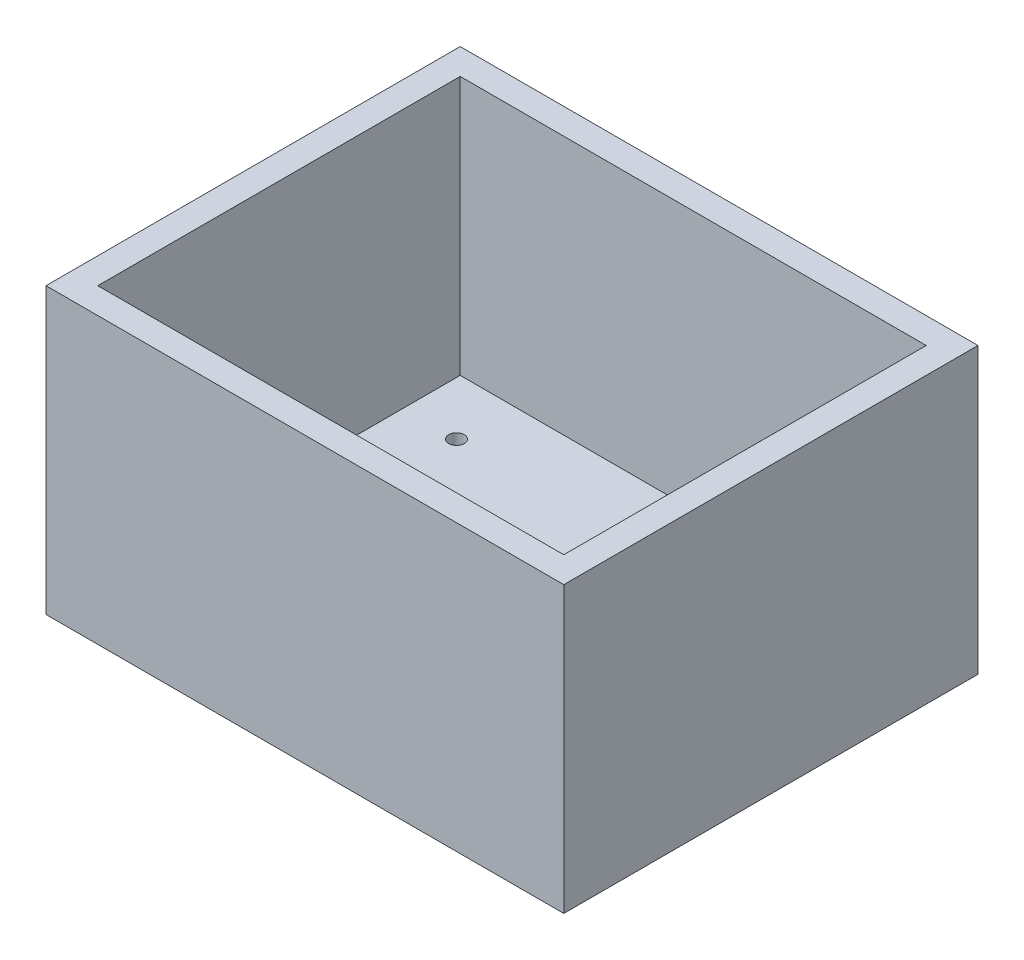
from build123d import *

# Parameters (mm, degrees)
SKETCH1_W           = 100
SKETCH1_H           = 80
BOSS_EXTRUDE1_DEPTH = 55
SKETCH3_W           = 90
SKETCH3_H           = 70
CUT_EXTRUDE1_DEPTH  = 50
SKETCH5_R           = 1.5
CUT_EXTRUDE2_DEPTH  = 50


with BuildPart() as part:
    # Sketch1 → Boss-Extrude1 (new body)
    with BuildSketch(Plane(origin=(0, 0, 0), x_dir=(1, 0, 0), z_dir=(0, 1, 0))):
        Rectangle(SKETCH1_W, SKETCH1_H)
    extrude(amount=BOSS_EXTRUDE1_DEPTH)

    # Sketch3 → Cut-Extrude1 (cut)
    with BuildSketch(Plane(origin=(0, 55, 0), x_dir=(1, 0, 0), z_dir=(0, 1, 0))):
        Rectangle(SKETCH3_W, SKETCH3_H)
    extrude(amount=-CUT_EXTRUDE1_DEPTH, mode=Mode.SUBTRACT)

    # Sketch5 → Cut-Extrude2 (cut)
    with BuildSketch(Plane(origin=(0, 5, 0), x_dir=(1, 0, 0), z_dir=(0, 1, 0))):
        with Locations(Location((-34.701504138, 23.983302554, 0), (0, 0, 270))):
            Circle(SKETCH5_R)
        with Locations(Location((34.701504138, 23.983302554, 0), (0, 0, 270))):
            Circle(SKETCH5_R)
        with Locations(Location((34.701504138, -23.983302554, 0), (0, 0, 270))):
            Circle(SKETCH5_R)
        with Locations(Location((-34.701504138, -23.983302554, 0), (0, 0, 270))):
            Circle(SKETCH5_R)
    extrude(amount=-CUT_EXTRUDE2_DEPTH, mode=Mode.SUBTRACT)


solid = part.part
